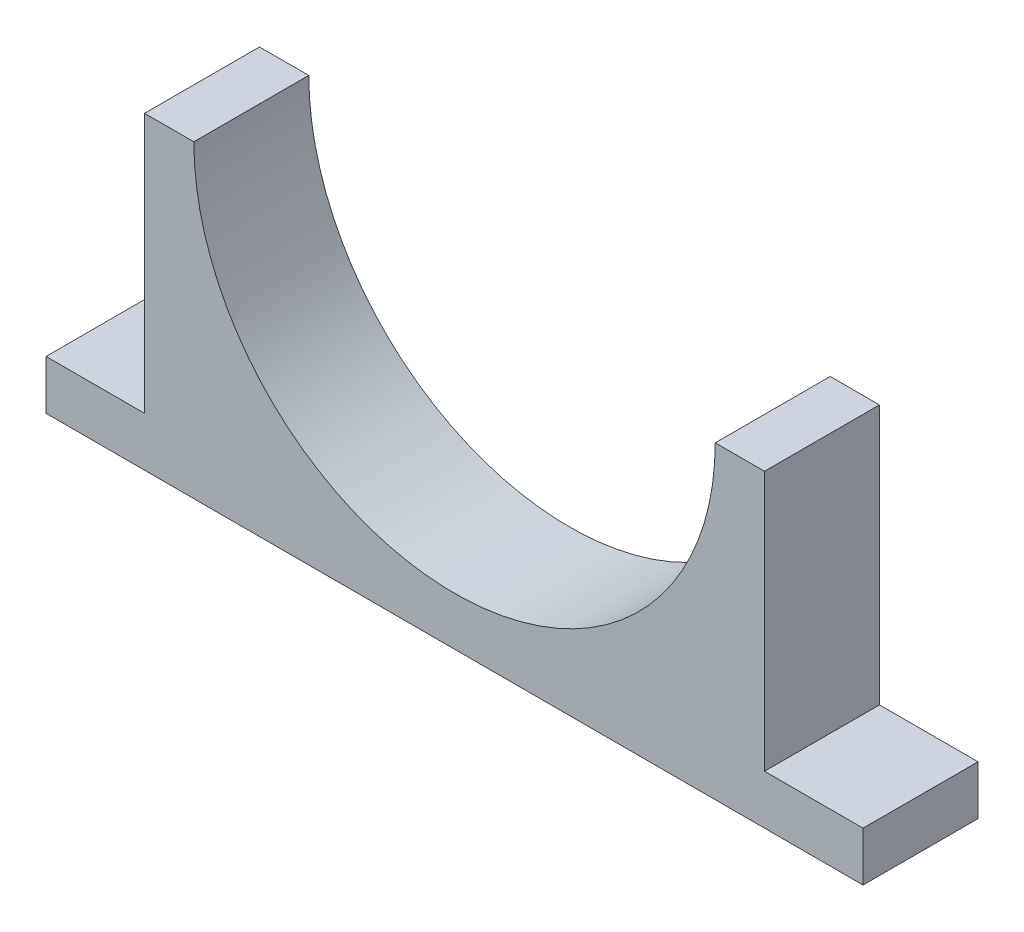
from build123d import *

# Parameters (mm, degrees)
BOSS_EXTRUDE1_DEPTH = 7


with BuildPart() as part:
    # Sketch1 → Boss-Extrude1 (new body)
    with BuildSketch(Plane.XY):
        with BuildLine():
            Line((-15.875, 0), (-18.875, 0))
            Line((-18.875, 0), (-18.875, -15.82))
            Line((-18.875, -15.82), (-24.875, -15.82))
            Line((-24.875, -15.82), (-24.875, -18.82))
            Line((-24.875, -18.82), (24.875, -18.82))
            Line((24.875, -18.82), (24.875, -15.82))
            Line((24.875, -15.82), (18.875, -15.82))
            Line((18.875, -15.82), (18.875, 0))
            Line((18.875, 0), (15.875, 0))
            ThreePointArc((15.875, 0), (0, -15.875), (-15.875, 0))
        make_face()
    extrude(amount=BOSS_EXTRUDE1_DEPTH)


solid = part.part
